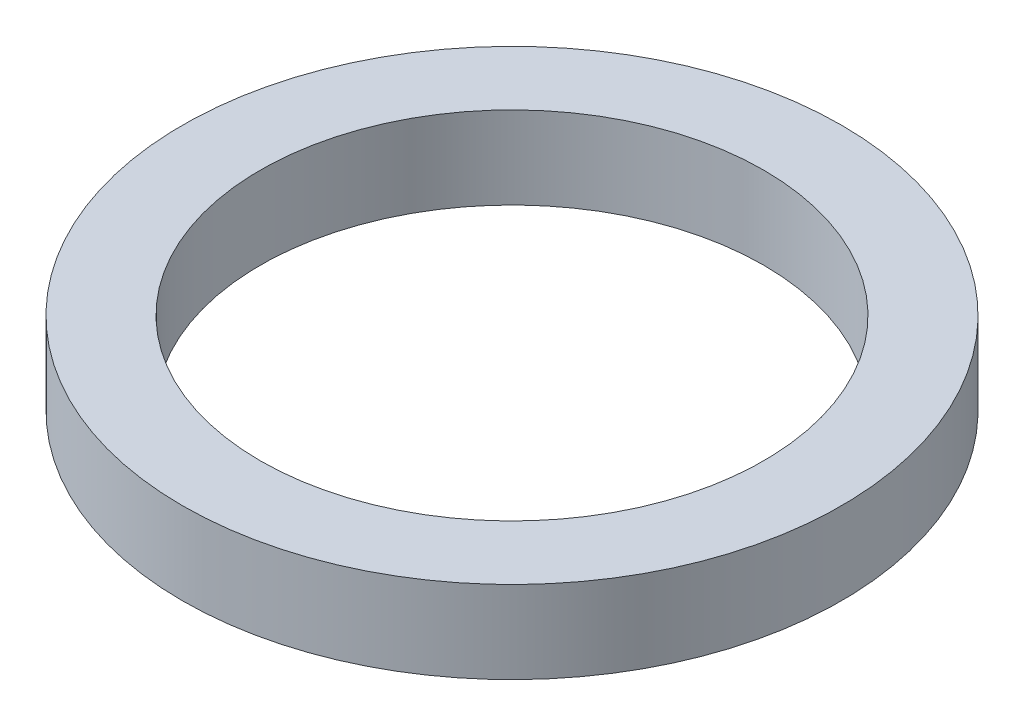
from build123d import *

# Parameters (mm, degrees)
SKETCH1_R           = 36
SKETCH1_R_2         = 27.5
BOSS_EXTRUDE1_DEPTH = 9


with BuildPart() as part:
    # Sketch1 → Boss-Extrude1 (new body)
    with BuildSketch(Plane(origin=(0, 0, 0), x_dir=(1, 0, 0), z_dir=(0, 1, 0))):
        with Locations(Location((0, 0, 0), (0, 0, 270))):
            Circle(SKETCH1_R)
        with Locations(Location((0, 0, 0), (0, 0, 270))):
            Circle(SKETCH1_R_2, mode=Mode.SUBTRACT)
    extrude(amount=BOSS_EXTRUDE1_DEPTH)


solid = part.part
